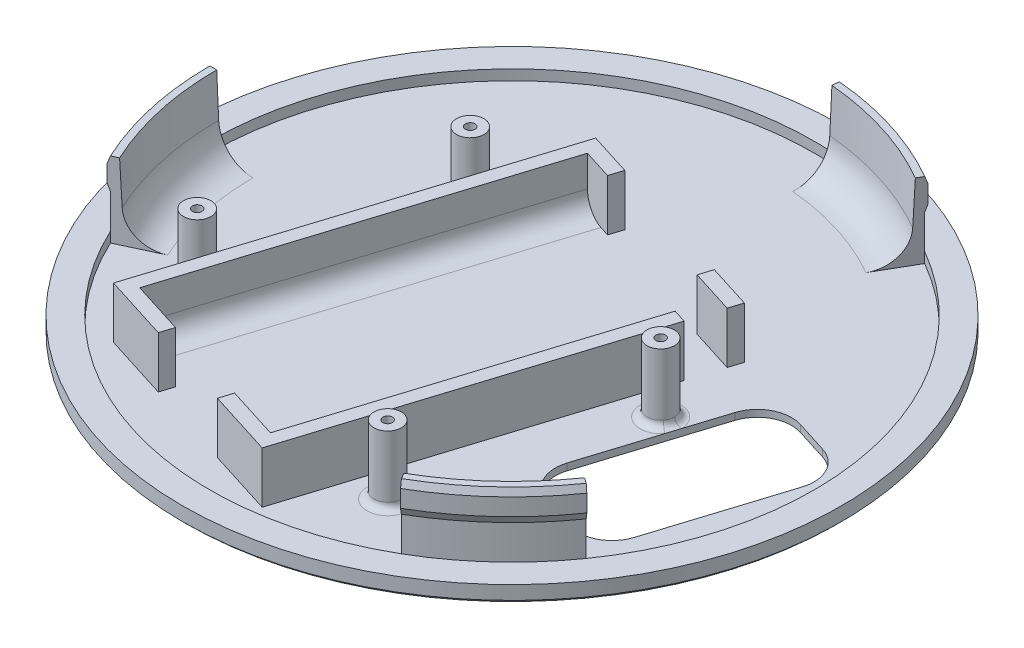
from build123d import *

# Parameters (mm, degrees)
SKETCH1_R           = 96.15
BOSS_EXTRUDE1_DEPTH = 5
SKETCH2_R           = 88.15
CUT_EXTRUDE1_DEPTH  = 3
REVOLVE1_ANGLE      = 25
CIRPATTERN1_COUNT   = 3
FILLET1_R           = 10
SKETCH4_R           = 4
SKETCH4_R_2         = 1.4
BOSS_EXTRUDE2_DEPTH = 20
CHAMFER1_SIZE       = 1
BOSS_EXTRUDE3_DEPTH = 15
CUT_EXTRUDE2_DEPTH  = 15
CUT_EXTRUDE3_DEPTH  = 138.744854729
FILLET2_R           = 10
FILLET3_R           = 2
FILLET4_R           = 6
CUT_EXTRUDE4_DEPTH  = 15


with BuildPart() as part:
    # Sketch1 → Boss-Extrude1 (new body)
    with BuildSketch(Plane(origin=(0, 0, 0), x_dir=(1, 0, 0), z_dir=(0, 1, 0))):
        with Locations(Location((0, 0, 0), (0, 0, 270))):
            Circle(SKETCH1_R)
    extrude(amount=BOSS_EXTRUDE1_DEPTH)

    # Sketch2 → Cut-Extrude1 (cut)
    with BuildSketch(Plane(origin=(0, 5, 0), x_dir=(1, 0, 0), z_dir=(0, 1, 0))):
        with Locations(Location((0, 0, 0), (0, 0, 270))):
            Circle(SKETCH2_R)
    extrude(amount=-CUT_EXTRUDE1_DEPTH, mode=Mode.SUBTRACT)

    # Sketch3 → Revolve1 (revolve)
    with BuildSketch(Plane.XY):
        Polygon((-88.15, 2), (-88.15, 15), (-88.877940469, 17), (-88.877940469, 22), (-88.15, 24), (-86.15, 24), (-85.15, 2), align=None)
    revolve1 = revolve(axis=Axis((0, 2, 0), (0, 1, 0)), revolution_arc=REVOLVE1_ANGLE)

    # CirPattern1: Revolve1 ×3 about axis
    cirpattern1_axis = Axis((0, 0, 0), (0, 1, 0))
    for i in range(1, CIRPATTERN1_COUNT):
        add(revolve1.rotate(cirpattern1_axis, i * 360 / CIRPATTERN1_COUNT))

    # Fillet1
    fillet1_edges = [part.edges().sort_by_distance(p)[0] for p in [
        (-83.131605006, 2, 18.429833127),
        (57.526506178, 2, 62.779165229),
        (25.605098828, 2, -81.208998356),
    ]]
    fillet(fillet1_edges, radius=FILLET1_R)

    # Sketch4 → Boss-Extrude2 (add)
    # profile 1 of 4: a face of its own
    with BuildSketch(Plane(origin=(0, 2, 0), x_dir=(1, 0, 0), z_dir=(0, 1, 0))):
        with Locations(Location((-36.838329564, 24.647548103, 0), (0, 0, 270))):
            Circle(SKETCH4_R)
        with Locations(Location((-36.838329564, 24.647548103, 0), (0, 0, 270))):
            Circle(SKETCH4_R_2, mode=Mode.SUBTRACT)
    # profile 2 of 4: a face of its own
    with BuildSketch(Plane(origin=(0, 2, 0), x_dir=(1, 0, 0), z_dir=(0, 1, 0))):
        with Locations(Location((44.313445776, -0.939508377, 0), (0, 0, 270))):
            Circle(SKETCH4_R)
        with Locations(Location((44.313445776, -0.939508377, 0), (0, 0, 270))):
            Circle(SKETCH4_R_2, mode=Mode.SUBTRACT)
    # profile 3 of 4: a face of its own
    with BuildSketch(Plane(origin=(0, 2, 0), x_dir=(1, 0, 0), z_dir=(0, 1, 0))):
        with Locations(Location((25.218627507, -61.50053475, 0), (0, 0, 270))):
            Circle(SKETCH4_R)
        with Locations(Location((25.218627507, -61.50053475, 0), (0, 0, 270))):
            Circle(SKETCH4_R_2, mode=Mode.SUBTRACT)
    # profile 4 of 4: a face of its own
    with BuildSketch(Plane(origin=(0, 2, 0), x_dir=(1, 0, 0), z_dir=(0, 1, 0))):
        with Locations(Location((-55.933147832, -35.91347827, 0), (0, 0, 270))):
            Circle(SKETCH4_R)
        with Locations(Location((-55.933147832, -35.91347827, 0), (0, 0, 270))):
            Circle(SKETCH4_R_2, mode=Mode.SUBTRACT)
    extrude(amount=BOSS_EXTRUDE2_DEPTH)

    # Chamfer1
    chamfer1_edges = [part.edges().sort_by_distance(p)[0] for p in [
        (0, 0, -96.15),
    ]]
    chamfer(chamfer1_edges, length=CHAMFER1_SIZE)

    # Sketch5 → Boss-Extrude3 (add)
    with BuildSketch(Plane(origin=(0, 2, 0), x_dir=(1, 0, 0), z_dir=(0, 1, 0))):
        Polygon((9.002514728, -81.887842353), (42.723663084, 25.061976503), (-20.622216784, 45.034855706), (-54.343365141, -61.91496315), align=None)
        Polygon((6.390470123, -76.870151352), (-49.32567414, -59.302918545), (-18.010172179, 40.017164705), (37.705972083, 22.449931898), align=None, mode=Mode.SUBTRACT)
    extrude(amount=BOSS_EXTRUDE3_DEPTH)

    # Sketch6 → Cut-Extrude2 (cut)
    with BuildSketch(Plane(origin=(0, 17, 0), x_dir=(1, 0, 0), z_dir=(0, 1, 0))):
        Polygon((28.721958407, 25.28258053), (29.924781605, 29.097448333), (-8.223896425, 41.125680313), (-9.426719623, 37.31081251), align=None)
        Polygon((34.698914088, 12.912762391), (37.705972083, 22.449931898), (41.520839886, 21.2471087), (38.513781891, 11.709939193), align=None)
    extrude(amount=-CUT_EXTRUDE2_DEPTH, mode=Mode.SUBTRACT)

    # Sketch7 → Cut-Extrude3 (cut, through all)
    with BuildSketch(Plane(origin=(0, 2, 0), x_dir=(1, 0, 0), z_dir=(0, 1, 0))):
        Polygon((39.287775175, -35.717910583), (57.029417346, 20.551389511), (85.640925868, 11.530215526), (67.899283697, -44.739084568), align=None)
    extrude(amount=-CUT_EXTRUDE3_DEPTH, mode=Mode.SUBTRACT)

    # Fillet2
    fillet2_edges = [part.edges().sort_by_distance(p)[0] for p in [
        (67.899283697, 1, 44.739084568),
        (39.287775175, 1, 35.717910583),
        (57.029417346, 1, -20.551389511),
        (85.640925868, 1, -11.530215526),
    ]]
    fillet(fillet2_edges, radius=FILLET2_R)

    # Fillet3
    fillet3_edges = [part.edges().sort_by_distance(p)[0] for p in [
        (-36.838329564, 2, -28.647548103),
        (44.313445776, 2, -3.060491623),
        (25.218627507, 2, 57.50053475),
        (-55.933147832, 2, 31.91347827),
    ]]
    fillet(fillet3_edges, radius=FILLET3_R)

    # Fillet4
    fillet4_edges = [part.edges().sort_by_distance(p)[0] for p in [
        (20.544692106, 2, 31.978694481),
        (-33.66792316, 2, 9.64287692),
    ]]
    fillet(fillet4_edges, radius=FILLET4_R)

    # Sketch8 → Cut-Extrude4 (cut)
    with BuildSketch(Plane(origin=(0, 17, 0), x_dir=(1, 0, 0), z_dir=(0, 1, 0))):
        Polygon((-10.071824287, -75.873726363), (-35.269026126, -67.92907914), (-34.066202928, -64.114211338), (-8.869001089, -72.05885856), align=None)
    extrude(amount=-CUT_EXTRUDE4_DEPTH, mode=Mode.SUBTRACT)


solid = part.part
